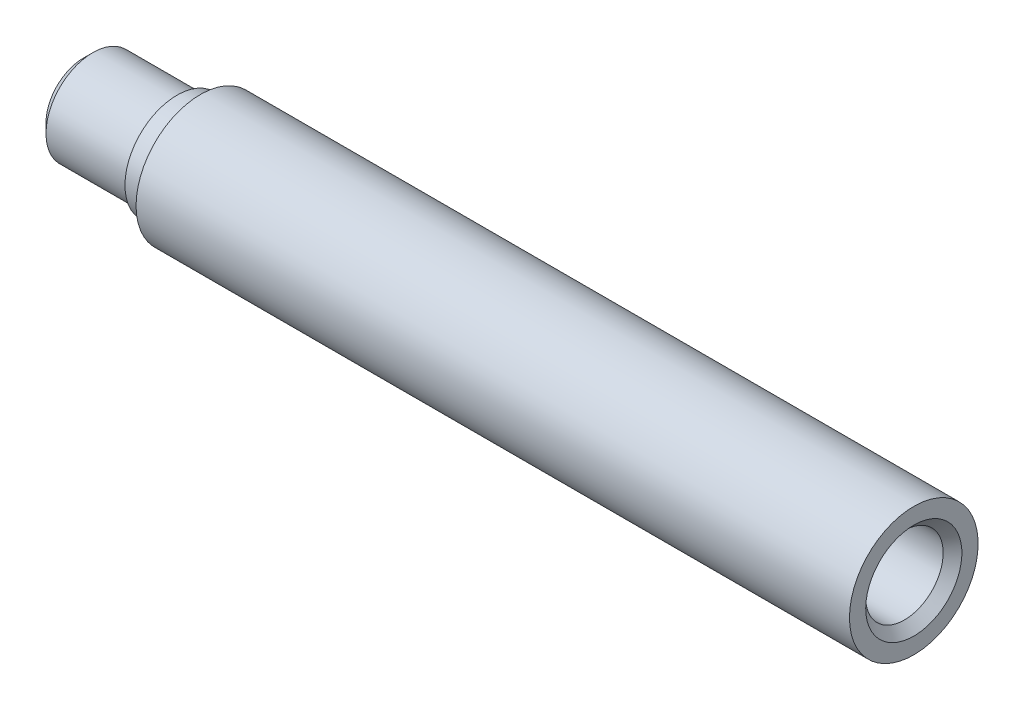
from build123d import *


with BuildPart() as part:
    # Sketch1 → Revolve1 (revolve)
    with BuildSketch(Plane(origin=(0, 0, 0), x_dir=(-1, 0, 0), z_dir=(0, 0, -1)), mode=Mode.PRIVATE) as revolve1_sk:
        Polygon((-19, 3.311374294), (-17.010325592, 0), (36, 0), (36, 3.2), (35.2, 4), (28, 4), (28, 4.45), (26, 4.45), (26, 5.5), (-35, 5.5), (-35, 4.111374294), (-34.2, 3.311374294), align=None)
    revolve(revolve1_sk.sketch.rotate(Axis((35, 0, 0), (-1, 0, 0)), 270), axis=Axis((35, 0, 0), (-1, 0, 0)))


solid = part.part
